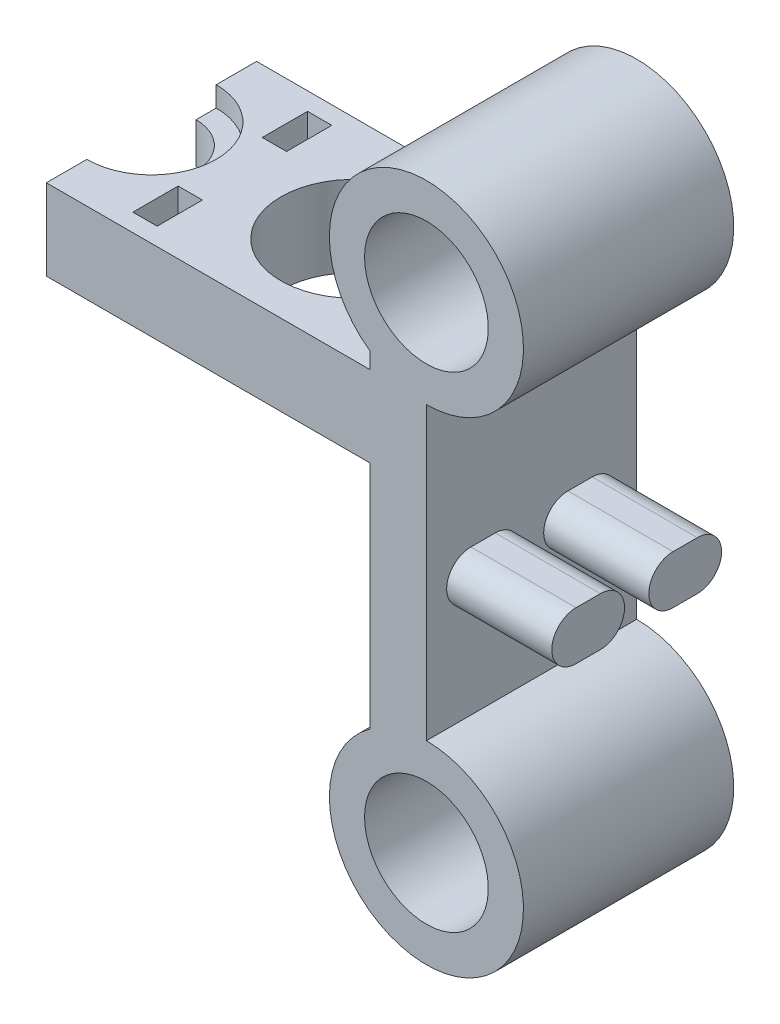
from build123d import *

# Parameters (mm, degrees)
ESBO_O1_R                = 7.65
RESSALTO_EXTRUS_O1_DEPTH = 26
ESBO_O4_R                = 1.75
CORTE_EXTRUS_O1_DEPTH    = 20
ESBO_O5_W                = 3
ESBO_O5_H                = 5.6
CORTE_EXTRUS_O2_DEPTH    = 25
RESSALTO_EXTRUS_O2_DEPTH = 13
ESBO_O7_R                = 9
CORTE_EXTRUS_O3_DEPTH    = 10


with BuildPart() as part:
    # Esboço1 → Ressalto-extrusão1 (new body)
    with BuildSketch(Plane.XY):
        with BuildLine():
            Line((-7, 20.253205655), (-7, 18.253205655))
            Line((-7, 18.253205655), (-47, 18.253205655))
            Line((-47, 18.253205655), (-47, 8.253205655))
            Line((-47, 8.253205655), (-7, 8.253205655))
            Line((-7, 8.253205655), (-7, -20.253205655))
            ThreePointArc((-7, -20.253205655), (3.676851089, -41.422817781), (0, -18))
            Line((0, -18), (0, 18))
            ThreePointArc((0, 18), (3.676851089, 41.422817781), (-7, 20.253205655))
        make_face()
        with Locations(Location((0, 30, 0), (0, 0, 180))):
            Circle(ESBO_O1_R, mode=Mode.SUBTRACT)
        with Locations(Location((0, -30, 0), (0, 0, 180))):
            Circle(ESBO_O1_R, mode=Mode.SUBTRACT)
    extrude(amount=RESSALTO_EXTRUS_O1_DEPTH)

    # Esboço3 → Corte-Revolução1 (revolve, cut)
    with BuildSketch(Plane.ZY.offset(47)):
        Polygon((13, 18.253205655), (21, 18.253205655), (21, 15.753205655), (18.5, 15.753205655), (18.5, 10.753205655), (21, 10.753205655), (21, 8.253205655), (13, 8.253205655), align=None)
    revolve(axis=Axis((-47, 18.253205655, 13), (0, -1, 0)), mode=Mode.SUBTRACT)

    # Esboço4 → Corte-extrusão1 (cut)
    with BuildSketch(Plane.ZY.offset(47)):
        with Locations((5, 13.253205655)):
            Circle(ESBO_O4_R)
        with Locations(Location((21, 13.253205655, 0), (0, 0, 180))):
            Circle(ESBO_O4_R)
    extrude(amount=-CORTE_EXTRUS_O1_DEPTH, mode=Mode.SUBTRACT)

    # Esboço5 → Corte-extrusão2 (cut)
    with BuildSketch(Plane(origin=(0, 18.253205655, 0), x_dir=(1, 0, 0), z_dir=(0, 1, 0))):
        with Locations((-37, -5)):
            Rectangle(ESBO_O5_W, ESBO_O5_H)
        with Locations((-37, -21)):
            Rectangle(ESBO_O5_W, ESBO_O5_H)
    extrude(amount=-CORTE_EXTRUS_O2_DEPTH, mode=Mode.SUBTRACT)

    # Esboço6 → Ressalto-extrusão2 (add)
    with BuildSketch(Plane(origin=(0, 0, 0), x_dir=(0, 0, -1), z_dir=(1, 0, 0))):
        with BuildLine():
            Line((-17.5, -6), (-20.5, -6))
            ThreePointArc((-20.5, -6), (-23.5, -3), (-20.5, 0))
            Line((-20.5, 0), (-17.5, 0))
            ThreePointArc((-17.5, 0), (-14.5, -3), (-17.5, -6))
        make_face()
        with BuildLine():
            Line((-8.5, -6), (-5.5, -6))
            ThreePointArc((-5.5, -6), (-2.5, -3), (-5.5, 0))
            Line((-5.5, 0), (-8.5, 0))
            ThreePointArc((-8.5, 0), (-11.5, -3), (-8.5, -6))
        make_face()
    extrude(amount=RESSALTO_EXTRUS_O2_DEPTH)

    # Esboço7 → Corte-extrusão3 (cut)
    with BuildSketch(Plane(origin=(0, 18.253205655, 0), x_dir=(1, 0, 0), z_dir=(0, 1, 0))):
        with Locations(Location((-22, -13, 0), (0, 0, 180))):
            Circle(ESBO_O7_R)
    extrude(amount=-CORTE_EXTRUS_O3_DEPTH, mode=Mode.SUBTRACT)


solid = part.part
